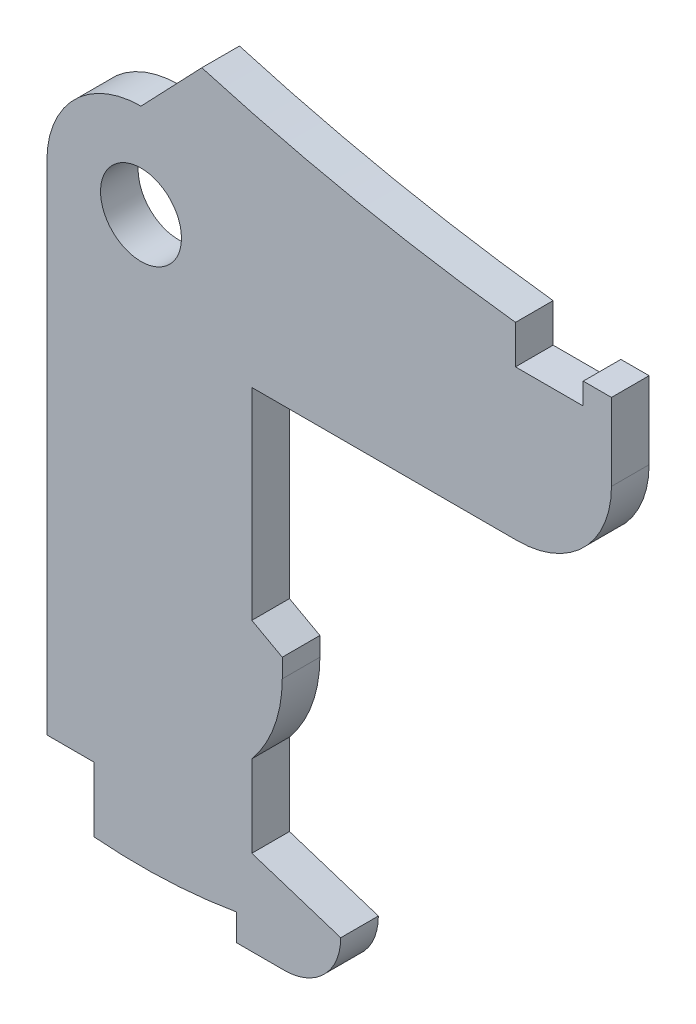
from build123d import *

# Parameters (mm, degrees)
SKETCH_1_R      = 2.15
EXTRUDE_1_DEPTH = 2


with BuildPart() as part:
    # 스케치1 → 보스-돌출1 (new body)
    with BuildSketch(Plane.XY):
        with BuildLine():
            Line((58.562856649, -69.110949309), (61.100431709, -69.110949309))
            ThreePointArc((61.100431709, -69.110949309), (63.221752053, -68.232269653), (64.100431709, -66.110949309))
            Line((64.100431709, -66.110949309), (59.376120264, -64.586771365))
            Line((59.376120264, -64.586771365), (59.376120264, -60.240028533))
            ThreePointArc((59.376120264, -60.240028533), (60.576391584, -58.13775418), (60.992924776, -55.753072063))
            Line((60.992924776, -55.753072063), (60.992924776, -54.755314285))
            Line((60.992924776, -54.755314285), (59.376120264, -53.867981647))
            Line((59.376120264, -53.867981647), (59.376120264, -43.149191929))
            Line((59.376120264, -43.149191929), (73.486715323, -43.149191929))
            ThreePointArc((73.486715323, -43.149191929), (77.022249229, -41.684725835), (78.486715323, -38.149191929))
            Line((78.486715323, -38.149191929), (78.486715323, -34.05327534))
            Line((78.486715323, -34.05327534), (76.986715323, -34.05327534))
            Line((76.986715323, -34.05327534), (76.986715323, -35.198463464))
            Line((76.986715323, -35.198463464), (73.386715323, -35.198463464))
            Line((73.386715323, -35.198463464), (73.386715323, -33.149191929))
            ThreePointArc((73.386715323, -33.149191929), (64.982885636, -31.8013595), (56.718627509, -29.765912799))
            Line((56.718627509, -29.765912799), (53.486715323, -33.149191929))
            ThreePointArc((53.486715323, -33.149191929), (49.951181417, -34.613658023), (48.486715323, -38.149191929))
            Line((48.486715323, -38.149191929), (48.486715323, -64.586869755))
            Line((48.486715323, -64.586869755), (50.986715323, -64.586869755))
            Line((50.986715323, -64.586869755), (50.986715323, -68.023666262))
            ThreePointArc((50.986715323, -68.023666262), (54.785213458, -68.09995351), (58.562856649, -67.695206989))
            Line((58.562856649, -67.695206989), (58.562856649, -69.110949309))
        make_face()
        with Locations((53.486715323, -38.149191929)):
            Circle(SKETCH_1_R, mode=Mode.SUBTRACT)
    extrude(amount=EXTRUDE_1_DEPTH)


solid = part.part
